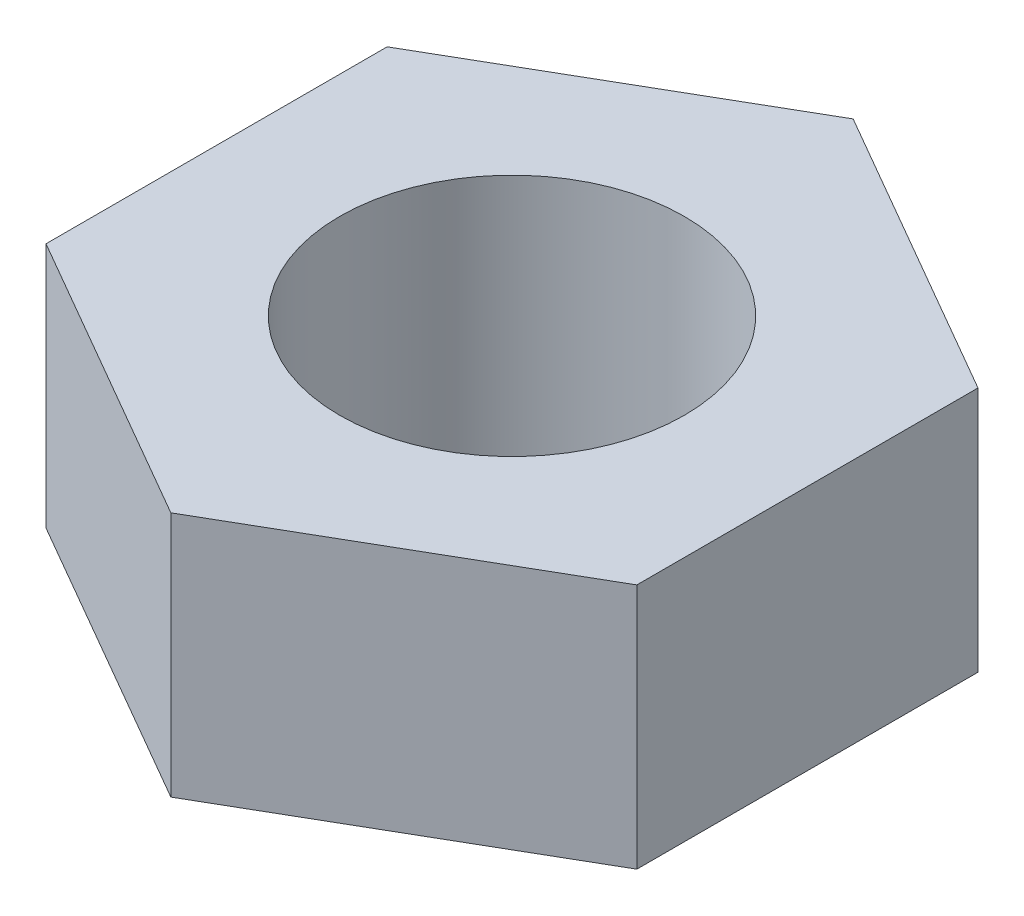
from build123d import *

# Parameters (mm, degrees)
SKETCH1_R           = 7
BOSS_EXTRUDE1_DEPTH = 10


with BuildPart() as part:
    # Sketch1 → Boss-Extrude1 (new body)
    with BuildSketch(Plane(origin=(0, 0, 0), x_dir=(1, 0, 0), z_dir=(0, 1, 0))):
        Polygon((-12, -6.92820323), (0, -13.856406461), (12, -6.92820323), (12, 6.92820323), (0, 13.856406461), (-12, 6.92820323), align=None)
        with Locations(Location((0, 0, 0), (0, 0, 270))):
            Circle(SKETCH1_R, mode=Mode.SUBTRACT)
    extrude(amount=BOSS_EXTRUDE1_DEPTH)


solid = part.part
